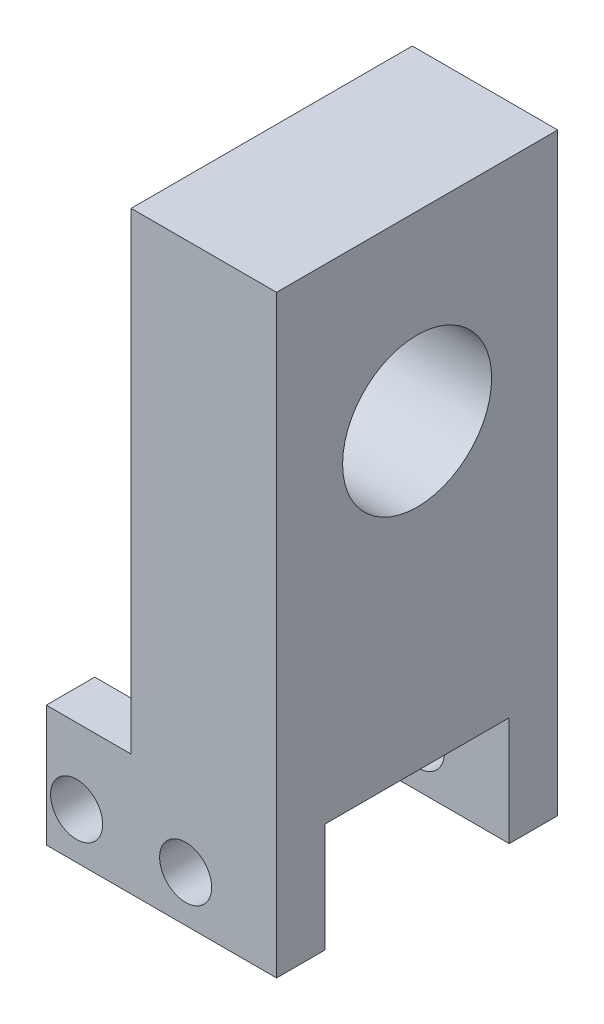
from build123d import *

# Parameters (mm, degrees)
GUIDED_START                               = 38.4
SKETCH1_W                                  = 12
SKETCH1_H                                  = 40
GUIDED_BRIDGE_WITH_ROD_COUPLING_SEAT_DEPTH = 23.2
LOWER_START                                = 38.4
SKETCH2_W                                  = 19
SKETCH2_H                                  = 10
LOWER_LAP_EAR_CLEARS_STOP_STATION_DEPTH    = 4
UPPER_START                                = 57.6
SKETCH3_W                                  = 19
SKETCH3_H                                  = 10
UPPER_LAP_EAR_CLEARS_STOP_STATION_DEPTH    = 4
M4_START                                   = 38.4
SKETCH4_R                                  = 2.15
M4_JOINT_BOLT_CLEARANCE_DEPTH              = 23.2
RADIAL_START                               = 65
SKETCH5_R                                  = 6.15
RADIAL_FLOATING_STUD_CLEARANCE_DEPTH       = 12


with BuildPart() as part:
    # Sketch1 → Guided bridge with rod coupling seat (new body)
    with BuildSketch(Plane.XY.offset(GUIDED_START)):
        with Locations((71, 64)):
            Rectangle(SKETCH1_W, SKETCH1_H)
    extrude(amount=GUIDED_BRIDGE_WITH_ROD_COUPLING_SEAT_DEPTH)

    # Sketch2 → Lower lap ear clears stop station (add)
    with BuildSketch(Plane.XY.offset(LOWER_START)):
        with Locations((67.5, 40)):
            Rectangle(SKETCH2_W, SKETCH2_H)
    extrude(amount=LOWER_LAP_EAR_CLEARS_STOP_STATION_DEPTH)

    # Sketch3 → Upper lap ear clears stop station (add)
    with BuildSketch(Plane.XY.offset(UPPER_START)):
        with Locations((67.5, 40)):
            Rectangle(SKETCH3_W, SKETCH3_H)
    extrude(amount=UPPER_LAP_EAR_CLEARS_STOP_STATION_DEPTH)

    # Sketch4 → M4 joint bolt clearance (cut)
    with BuildSketch(Plane.XY.offset(M4_START)):
        with Locations((60.5, 38.8)):
            Circle(SKETCH4_R)
        with Locations((69.5, 38.8)):
            Circle(SKETCH4_R)
    extrude(amount=M4_JOINT_BOLT_CLEARANCE_DEPTH, mode=Mode.SUBTRACT)

    # Sketch5 → Radial floating stud clearance (cut)
    with BuildSketch(Plane(origin=(0, 0, 0), x_dir=(0, 0, -1), z_dir=(1, 0, 0)).offset(RADIAL_START)):
        with Locations((-50, 69)):
            Circle(SKETCH5_R)
    extrude(amount=RADIAL_FLOATING_STUD_CLEARANCE_DEPTH, mode=Mode.SUBTRACT)


solid = part.part
